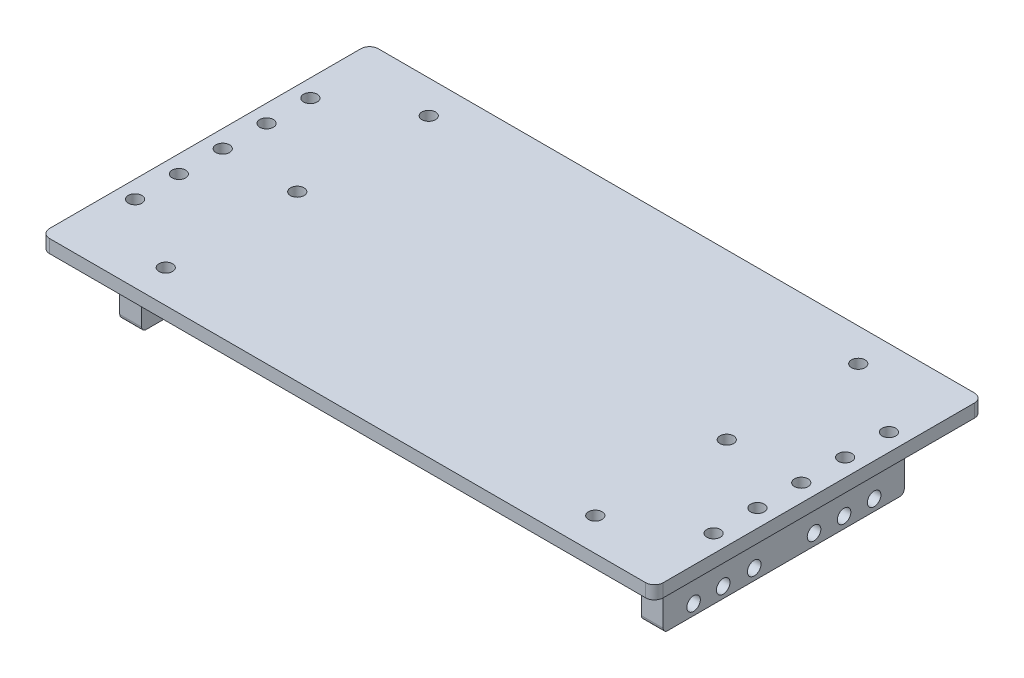
from build123d import *

# Parameters (mm, degrees)
SKETCH_1_W          = 140
SKETCH_1_H          = 75
EXTRUDE_1_DEPTH     = 3
SKETCH_2_R          = 1.55
CUT_EXTRUDE_1_DEPTH = 3
SKETCH_3_W          = 5
SKETCH_3_H          = 55
EXTRUDE_2_DEPTH     = 15
SKETCH_5_R          = 1.55
CUT_EXTRUDE_2_DEPTH = 15
SKETCH_6_R          = 1.55
CUT_EXTRUDE_3_DEPTH = 15
FILLET_1_R          = 2
FILLET_2_R          = 1


with BuildPart() as part:
    # 草图1 → 凸台-拉伸1 (new body)
    with BuildSketch(Plane(origin=(0, 0, 0), x_dir=(1, 0, 0), z_dir=(0, 1, 0))):
        Rectangle(SKETCH_1_W, SKETCH_1_H)
    extrude(amount=EXTRUDE_1_DEPTH)

    # 草图2 → 切除-拉伸1 (cut)
    with BuildSketch(Plane.XZ):
        with Locations(Location((-49, 0, 0), (0, 0, 270))):
            Circle(SKETCH_2_R)
        with Locations(Location((-49, -30, 0), (0, 0, 270))):
            Circle(SKETCH_2_R)
        with Locations(Location((-49, 30, 0), (0, 0, 270))):
            Circle(SKETCH_2_R)
        with Locations(Location((49, 30, 0), (0, 0, 270))):
            Circle(SKETCH_2_R)
        with Locations(Location((49, 0, 0), (0, 0, 270))):
            Circle(SKETCH_2_R)
        with Locations(Location((49, -30, 0), (0, 0, 270))):
            Circle(SKETCH_2_R)
    extrude(amount=-CUT_EXTRUDE_1_DEPTH, mode=Mode.SUBTRACT)

    # 草图3 → 凸台-拉伸2 (add)
    with BuildSketch(Plane.XZ):
        with Locations((-59.5, 0)):
            Rectangle(SKETCH_3_W, SKETCH_3_H)
        with Locations((59.5, 0)):
            Rectangle(SKETCH_3_W, SKETCH_3_H)
    extrude(amount=EXTRUDE_2_DEPTH)

    # 草图5 → 切除-拉伸2 (cut)
    with BuildSketch(Plane.XZ):
        with Locations(Location((-66, 20, 0), (0, 0, 270))):
            Circle(SKETCH_5_R)
        with Locations(Location((-66, 10, 0), (0, 0, 270))):
            Circle(SKETCH_5_R)
        with Locations(Location((-66, 0, 0), (0, 0, 270))):
            Circle(SKETCH_5_R)
        with Locations(Location((-66, -10, 0), (0, 0, 270))):
            Circle(SKETCH_5_R)
        with Locations(Location((-66, -20, 0), (0, 0, 270))):
            Circle(SKETCH_5_R)
        with Locations(Location((66, -20, 0), (0, 0, 270))):
            Circle(SKETCH_5_R)
        with Locations(Location((66, -10, 0), (0, 0, 270))):
            Circle(SKETCH_5_R)
        with Locations(Location((66, 0, 0), (0, 0, 270))):
            Circle(SKETCH_5_R)
        with Locations(Location((66, 10, 0), (0, 0, 270))):
            Circle(SKETCH_5_R)
        with Locations(Location((66, 20, 0), (0, 0, 270))):
            Circle(SKETCH_5_R)
    extrude(amount=-CUT_EXTRUDE_2_DEPTH, mode=Mode.SUBTRACT)

    # 草图6 → 切除-拉伸3 (cut)
    with BuildSketch(Plane.ZY.offset(62)):
        with Locations((-20.625, -12.5)):
            Circle(SKETCH_6_R)
        with Locations((-13.766824394, -12.463345811)):
            Circle(SKETCH_6_R)
        with Locations((-6.911518496, -12.401024848)):
            Circle(SKETCH_6_R)
        with Locations((6.736772336, -12.494506292)):
            Circle(SKETCH_6_R)
        with Locations((13.810201603, -12.556827255)):
            Circle(SKETCH_6_R)
        with Locations((20.572026056, -12.587987736)):
            Circle(SKETCH_6_R)
    cut_extrude_3 = extrude(amount=-CUT_EXTRUDE_3_DEPTH, mode=Mode.SUBTRACT)

    # 镜向1: 切除-拉伸3 across plane
    add(cut_extrude_3.mirror(Plane(origin=(0, 0, 0), x_dir=(0, 0, 1), z_dir=(1, 0, 0))), mode=Mode.SUBTRACT)

    # 圆角1
    fillet_1_edges = [part.edges().sort_by_distance(p)[0] for p in [
        (70, 1.5, 37.5),
        (70, 1.5, -37.5),
        (-70, 1.5, -37.5),
        (-70, 1.5, 37.5),
    ]]
    fillet(fillet_1_edges, radius=FILLET_1_R)

    # 圆角2
    fillet_2_edges = [part.edges().sort_by_distance(p)[0] for p in [
        (-59.5, 0, 27.5),
        (-62, 0, 0),
        (-59.5, 0, -27.5),
        (-57, 0, 0),
        (-59.5, -15, 27.5),
        (-59.5, -15, -27.5),
        (59.5, 0, -27.5),
        (62, 0, 0),
        (59.5, 0, 27.5),
        (57, 0, 0),
        (59.5, -15, -27.5),
        (59.5, -15, 27.5),
    ]]
    fillet(fillet_2_edges, radius=FILLET_2_R)


solid = part.part
